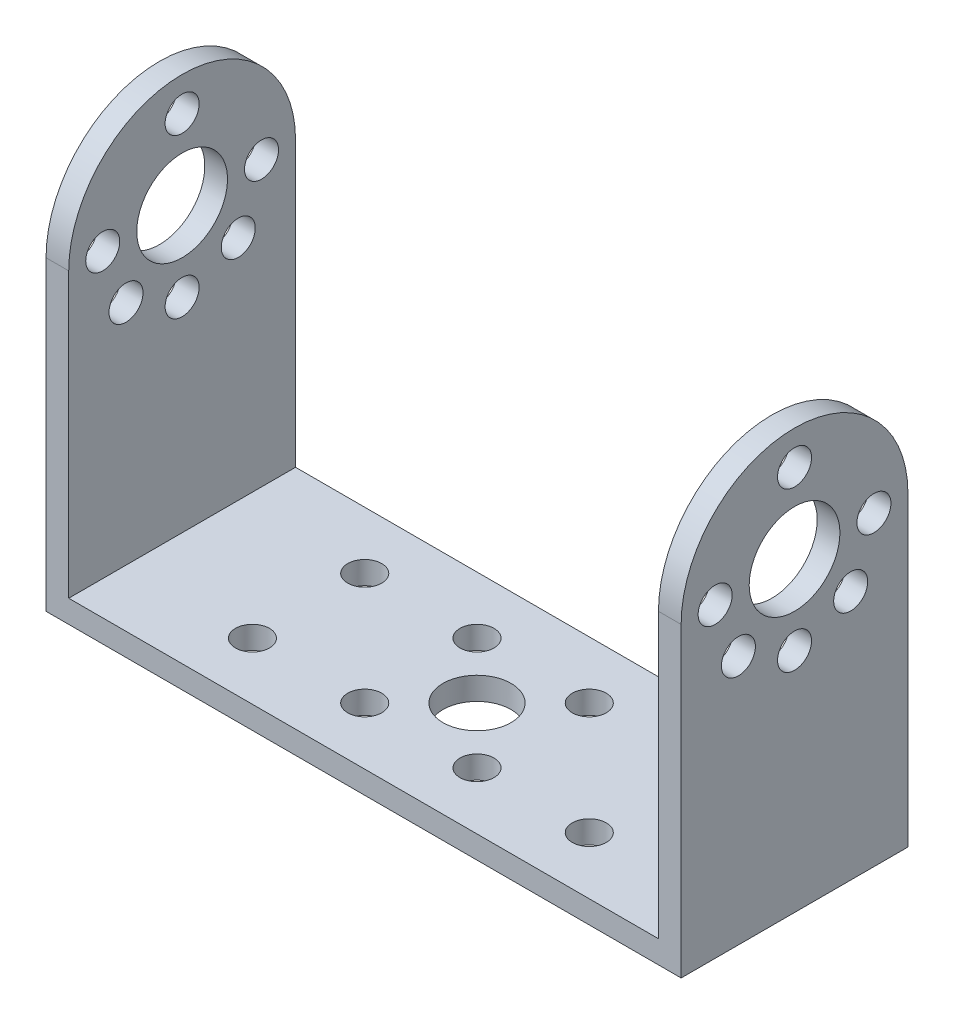
from build123d import *

# Parameters (mm, degrees)
SKETCH_1_W          = 56
SKETCH_1_H          = 20
EXTRUDE_1_DEPTH     = 2
CUT_EXTRUDE_1_REACH = 61.498
SKETCH_2_R          = 3
SKETCH_2_R_2        = 1.5
EXTRUDE_2_DEPTH     = 2
CUT_EXTRUDE_2_REACH = 72.036
SKETCH_4_R          = 4
SKETCH_4_R_2        = 1.5


with BuildPart() as part:
    # 草图1 → 凸台-拉伸1 (new body)
    with BuildSketch(Plane(origin=(0, 0, 0), x_dir=(1, 0, 0), z_dir=(0, 1, 0))):
        with Locations((28, 10)):
            Rectangle(SKETCH_1_W, SKETCH_1_H)
    extrude(amount=EXTRUDE_1_DEPTH)

    # 草图2 → 切除-拉伸1 (cut, up to next)
    with BuildSketch(Plane(origin=(0, 2, 0), x_dir=(1, 0, 0), z_dir=(0, 1, 0)), mode=Mode.PRIVATE) as cut_extrude_1_sk1:
        with Locations(Location((28, 10, 0), (0, 0, 270))):
            Circle(SKETCH_2_R)
    cut_extrude_1_tool1 = extrude(cut_extrude_1_sk1.sketch, amount=-CUT_EXTRUDE_1_REACH, mode=Mode.PRIVATE) & part.part
    # 草图2 → 切除-拉伸1 (cut, up to next)
    with BuildSketch(Plane(origin=(0, 2, 0), x_dir=(1, 0, 0), z_dir=(0, 1, 0)), mode=Mode.PRIVATE) as cut_extrude_1_sk2:
        with Locations(Location((32.949747468, 5.050252532, 0), (0, 0, 270))):
            Circle(SKETCH_2_R_2)
    cut_extrude_1_tool2 = extrude(cut_extrude_1_sk2.sketch, amount=-CUT_EXTRUDE_1_REACH, mode=Mode.PRIVATE) & part.part
    # 草图2 → 切除-拉伸1 (cut, up to next)
    with BuildSketch(Plane(origin=(0, 2, 0), x_dir=(1, 0, 0), z_dir=(0, 1, 0)), mode=Mode.PRIVATE) as cut_extrude_1_sk3:
        with Locations(Location((23.050252532, 5.050252532, 0), (0, 0, 270))):
            Circle(SKETCH_2_R_2)
    cut_extrude_1_tool3 = extrude(cut_extrude_1_sk3.sketch, amount=-CUT_EXTRUDE_1_REACH, mode=Mode.PRIVATE) & part.part
    # 草图2 → 切除-拉伸1 (cut, up to next)
    with BuildSketch(Plane(origin=(0, 2, 0), x_dir=(1, 0, 0), z_dir=(0, 1, 0)), mode=Mode.PRIVATE) as cut_extrude_1_sk4:
        with Locations(Location((23.050252532, 14.949747468, 0), (0, 0, 270))):
            Circle(SKETCH_2_R_2)
    cut_extrude_1_tool4 = extrude(cut_extrude_1_sk4.sketch, amount=-CUT_EXTRUDE_1_REACH, mode=Mode.PRIVATE) & part.part
    # 草图2 → 切除-拉伸1 (cut, up to next)
    with BuildSketch(Plane(origin=(0, 2, 0), x_dir=(1, 0, 0), z_dir=(0, 1, 0)), mode=Mode.PRIVATE) as cut_extrude_1_sk5:
        with Locations(Location((32.949747468, 14.949747468, 0), (0, 0, 270))):
            Circle(SKETCH_2_R_2)
    cut_extrude_1_tool5 = extrude(cut_extrude_1_sk5.sketch, amount=-CUT_EXTRUDE_1_REACH, mode=Mode.PRIVATE) & part.part
    # 草图2 → 切除-拉伸1 (cut, up to next)
    with BuildSketch(Plane(origin=(0, 2, 0), x_dir=(1, 0, 0), z_dir=(0, 1, 0)), mode=Mode.PRIVATE) as cut_extrude_1_sk6:
        with Locations(Location((13.150757595, 14.949747468, 0), (0, 0, 270))):
            Circle(SKETCH_2_R_2)
    cut_extrude_1_tool6 = extrude(cut_extrude_1_sk6.sketch, amount=-CUT_EXTRUDE_1_REACH, mode=Mode.PRIVATE) & part.part
    # 草图2 → 切除-拉伸1 (cut, up to next)
    with BuildSketch(Plane(origin=(0, 2, 0), x_dir=(1, 0, 0), z_dir=(0, 1, 0)), mode=Mode.PRIVATE) as cut_extrude_1_sk7:
        with Locations(Location((13.150757595, 5.050252532, 0), (0, 0, 90))):
            Circle(SKETCH_2_R_2)
    cut_extrude_1_tool7 = extrude(cut_extrude_1_sk7.sketch, amount=-CUT_EXTRUDE_1_REACH, mode=Mode.PRIVATE) & part.part
    # 草图2 → 切除-拉伸1 (cut, up to next)
    with BuildSketch(Plane(origin=(0, 2, 0), x_dir=(1, 0, 0), z_dir=(0, 1, 0)), mode=Mode.PRIVATE) as cut_extrude_1_sk8:
        with Locations(Location((42.849242405, 5.050252532, 0), (0, 0, 270))):
            Circle(SKETCH_2_R_2)
    cut_extrude_1_tool8 = extrude(cut_extrude_1_sk8.sketch, amount=-CUT_EXTRUDE_1_REACH, mode=Mode.PRIVATE) & part.part
    # 草图2 → 切除-拉伸1 (cut, up to next)
    with BuildSketch(Plane(origin=(0, 2, 0), x_dir=(1, 0, 0), z_dir=(0, 1, 0)), mode=Mode.PRIVATE) as cut_extrude_1_sk9:
        with Locations(Location((42.849242405, 14.949747468, 0), (0, 0, 90))):
            Circle(SKETCH_2_R_2)
    cut_extrude_1_tool9 = extrude(cut_extrude_1_sk9.sketch, amount=-CUT_EXTRUDE_1_REACH, mode=Mode.PRIVATE) & part.part
    add(cut_extrude_1_tool1.solids().sort_by_distance((28, 2, -10))[0], mode=Mode.SUBTRACT)
    add(cut_extrude_1_tool2.solids().sort_by_distance((32.949747, 2, -5.050253))[0], mode=Mode.SUBTRACT)
    add(cut_extrude_1_tool3.solids().sort_by_distance((23.050253, 2, -5.050253))[0], mode=Mode.SUBTRACT)
    add(cut_extrude_1_tool4.solids().sort_by_distance((23.050253, 2, -14.949747))[0], mode=Mode.SUBTRACT)
    add(cut_extrude_1_tool5.solids().sort_by_distance((32.949747, 2, -14.949747))[0], mode=Mode.SUBTRACT)
    add(cut_extrude_1_tool6.solids().sort_by_distance((13.150758, 2, -14.949747))[0], mode=Mode.SUBTRACT)
    add(cut_extrude_1_tool7.solids().sort_by_distance((13.150758, 2, -5.050253))[0], mode=Mode.SUBTRACT)
    add(cut_extrude_1_tool8.solids().sort_by_distance((42.849242, 2, -5.050253))[0], mode=Mode.SUBTRACT)
    add(cut_extrude_1_tool9.solids().sort_by_distance((42.849242, 2, -14.949747))[0], mode=Mode.SUBTRACT)

    # 草图3 → 凸台-拉伸2 (add)
    with BuildSketch(Plane.ZY):
        with BuildLine():
            Line((-20, 2), (0, 2))
            Line((0, 2), (0, 27))
            ThreePointArc((0, 27), (-10, 37), (-20, 27))
            Line((-20, 27), (-20, 2))
        make_face()
    extrude_2 = extrude(amount=-EXTRUDE_2_DEPTH)

    # 草图4 → 切除-拉伸2 (cut, up to next)
    with BuildSketch(Plane.ZY, mode=Mode.PRIVATE) as cut_extrude_2_sk1:
        with Locations((-10, 27)):
            Circle(SKETCH_4_R)
    cut_extrude_2_tool1 = extrude(cut_extrude_2_sk1.sketch, amount=-CUT_EXTRUDE_2_REACH, mode=Mode.PRIVATE) & part.part
    # 草图4 → 切除-拉伸2 (cut, up to next)
    with BuildSketch(Plane.ZY, mode=Mode.PRIVATE) as cut_extrude_2_sk2:
        with Locations((-10, 34)):
            Circle(SKETCH_4_R_2)
    cut_extrude_2_tool2 = extrude(cut_extrude_2_sk2.sketch, amount=-CUT_EXTRUDE_2_REACH, mode=Mode.PRIVATE) & part.part
    # 草图4 → 切除-拉伸2 (cut, up to next)
    with BuildSketch(Plane.ZY, mode=Mode.PRIVATE) as cut_extrude_2_sk3:
        with Locations((-3, 27)):
            Circle(SKETCH_4_R_2)
    cut_extrude_2_tool3 = extrude(cut_extrude_2_sk3.sketch, amount=-CUT_EXTRUDE_2_REACH, mode=Mode.PRIVATE) & part.part
    # 草图4 → 切除-拉伸2 (cut, up to next)
    with BuildSketch(Plane.ZY, mode=Mode.PRIVATE) as cut_extrude_2_sk4:
        with Locations((-5.050252532, 22.050252532)):
            Circle(SKETCH_4_R_2)
    cut_extrude_2_tool4 = extrude(cut_extrude_2_sk4.sketch, amount=-CUT_EXTRUDE_2_REACH, mode=Mode.PRIVATE) & part.part
    # 草图4 → 切除-拉伸2 (cut, up to next)
    with BuildSketch(Plane.ZY, mode=Mode.PRIVATE) as cut_extrude_2_sk5:
        with Locations((-10, 20)):
            Circle(SKETCH_4_R_2)
    cut_extrude_2_tool5 = extrude(cut_extrude_2_sk5.sketch, amount=-CUT_EXTRUDE_2_REACH, mode=Mode.PRIVATE) & part.part
    # 草图4 → 切除-拉伸2 (cut, up to next)
    with BuildSketch(Plane.ZY, mode=Mode.PRIVATE) as cut_extrude_2_sk6:
        with Locations((-14.949747468, 22.050252532)):
            Circle(SKETCH_4_R_2)
    cut_extrude_2_tool6 = extrude(cut_extrude_2_sk6.sketch, amount=-CUT_EXTRUDE_2_REACH, mode=Mode.PRIVATE) & part.part
    # 草图4 → 切除-拉伸2 (cut, up to next)
    with BuildSketch(Plane.ZY, mode=Mode.PRIVATE) as cut_extrude_2_sk7:
        with Locations((-17, 27)):
            Circle(SKETCH_4_R_2)
    cut_extrude_2_tool7 = extrude(cut_extrude_2_sk7.sketch, amount=-CUT_EXTRUDE_2_REACH, mode=Mode.PRIVATE) & part.part
    cut_extrude_2_1 = cut_extrude_2_tool1.solids().sort_by_distance((0, 27, -10))[0]
    add(cut_extrude_2_1, mode=Mode.SUBTRACT)
    cut_extrude_2_2 = cut_extrude_2_tool2.solids().sort_by_distance((0, 34, -10))[0]
    add(cut_extrude_2_2, mode=Mode.SUBTRACT)
    cut_extrude_2_3 = cut_extrude_2_tool3.solids().sort_by_distance((0, 27, -3))[0]
    add(cut_extrude_2_3, mode=Mode.SUBTRACT)
    cut_extrude_2_4 = cut_extrude_2_tool4.solids().sort_by_distance((0, 22.050253, -5.050253))[0]
    add(cut_extrude_2_4, mode=Mode.SUBTRACT)
    cut_extrude_2_5 = cut_extrude_2_tool5.solids().sort_by_distance((0, 20, -10))[0]
    add(cut_extrude_2_5, mode=Mode.SUBTRACT)
    cut_extrude_2_6 = cut_extrude_2_tool6.solids().sort_by_distance((0, 22.050253, -14.949747))[0]
    add(cut_extrude_2_6, mode=Mode.SUBTRACT)
    cut_extrude_2_7 = cut_extrude_2_tool7.solids().sort_by_distance((0, 27, -17))[0]
    add(cut_extrude_2_7, mode=Mode.SUBTRACT)
    cut_extrude_2 = cut_extrude_2_1 + cut_extrude_2_2 + cut_extrude_2_3 + cut_extrude_2_4 + cut_extrude_2_5 + cut_extrude_2_6 + cut_extrude_2_7  # 切除-拉伸2 as one shape, for the pattern or mirror that repeats it

    # 镜向1: 凸台-拉伸2, 切除-拉伸2 across plane
    add(extrude_2.mirror(Plane.ZY.offset(-28)))
    add(cut_extrude_2.mirror(Plane.ZY.offset(-28)), mode=Mode.SUBTRACT)


solid = part.part
